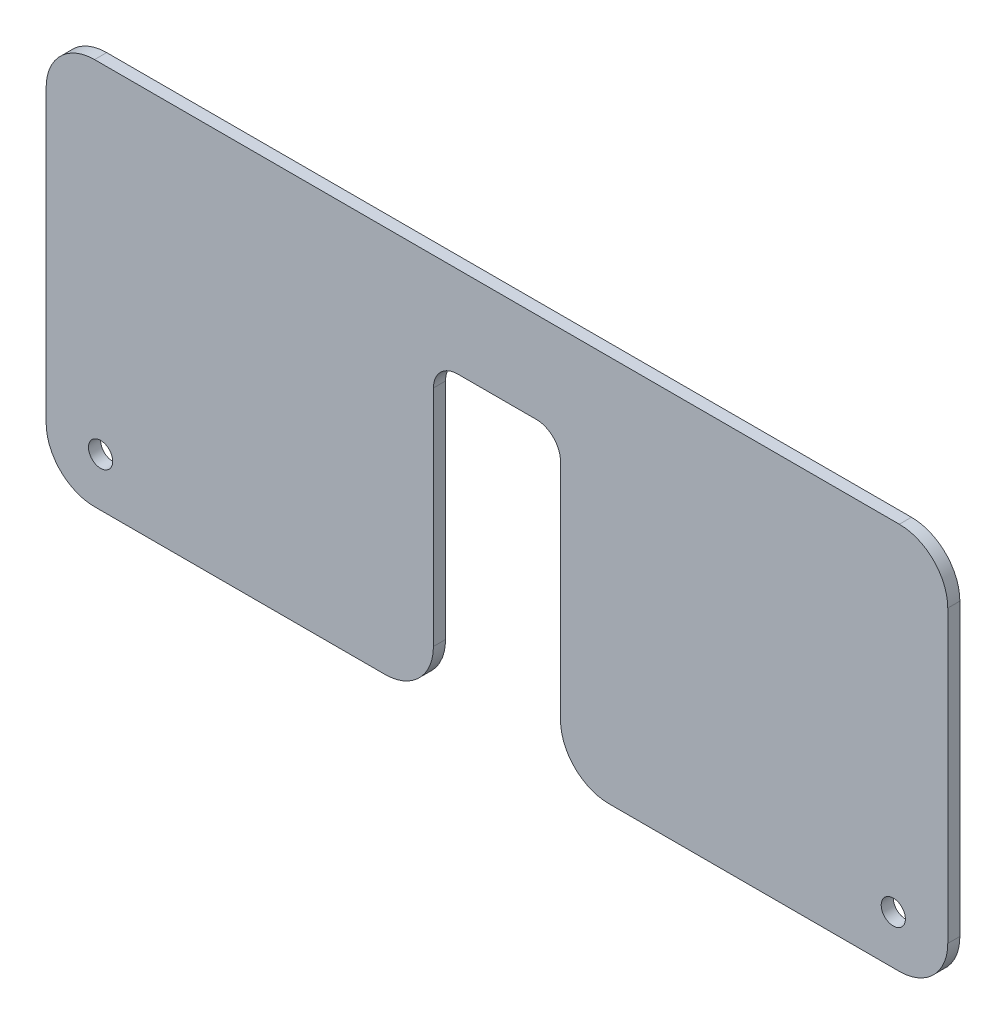
from build123d import *

# Parameters (mm, degrees)
SKETCH1_R           = 2
BOSS_EXTRUDE1_DEPTH = 2


with BuildPart() as part:
    # Sketch1 → Boss-Extrude1 (new body)
    with BuildSketch(Plane.XY):
        with BuildLine():
            Line((0, 0), (-66.5, 0))
            ThreePointArc((-66.5, 0), (-72.156854249, -2.343145751), (-74.5, -8))
            Line((-74.5, -8), (-74.5, -56))
            ThreePointArc((-74.5, -56), (-72.156854249, -61.656854249), (-66.5, -64))
            Line((-66.5, -64), (-18.5, -64))
            ThreePointArc((-18.5, -64), (-12.843145751, -61.656854249), (-10.5, -56))
            Line((-10.5, -56), (-10.5, -19))
            ThreePointArc((-10.5, -19), (-9.328427125, -16.171572875), (-6.5, -15))
            Line((-6.5, -15), (0, -15))
            Line((0, -15), (6.5, -15))
            ThreePointArc((6.5, -15), (9.328427125, -16.171572875), (10.5, -19))
            Line((10.5, -19), (10.5, -56))
            ThreePointArc((10.5, -56), (12.843145751, -61.656854249), (18.5, -64))
            Line((18.5, -64), (66.5, -64))
            ThreePointArc((66.5, -64), (72.156854249, -61.656854249), (74.5, -56))
            Line((74.5, -56), (74.5, -8))
            ThreePointArc((74.5, -8), (72.156854249, -2.343145751), (66.5, 0))
            Line((66.5, 0), (0, 0))
        make_face()
        with Locations((-65.5, -56)):
            Circle(SKETCH1_R, mode=Mode.SUBTRACT)
        with Locations(Location((65.5, -56, 0), (0, 0, 180))):
            Circle(SKETCH1_R, mode=Mode.SUBTRACT)
    extrude(amount=BOSS_EXTRUDE1_DEPTH)


solid = part.part
